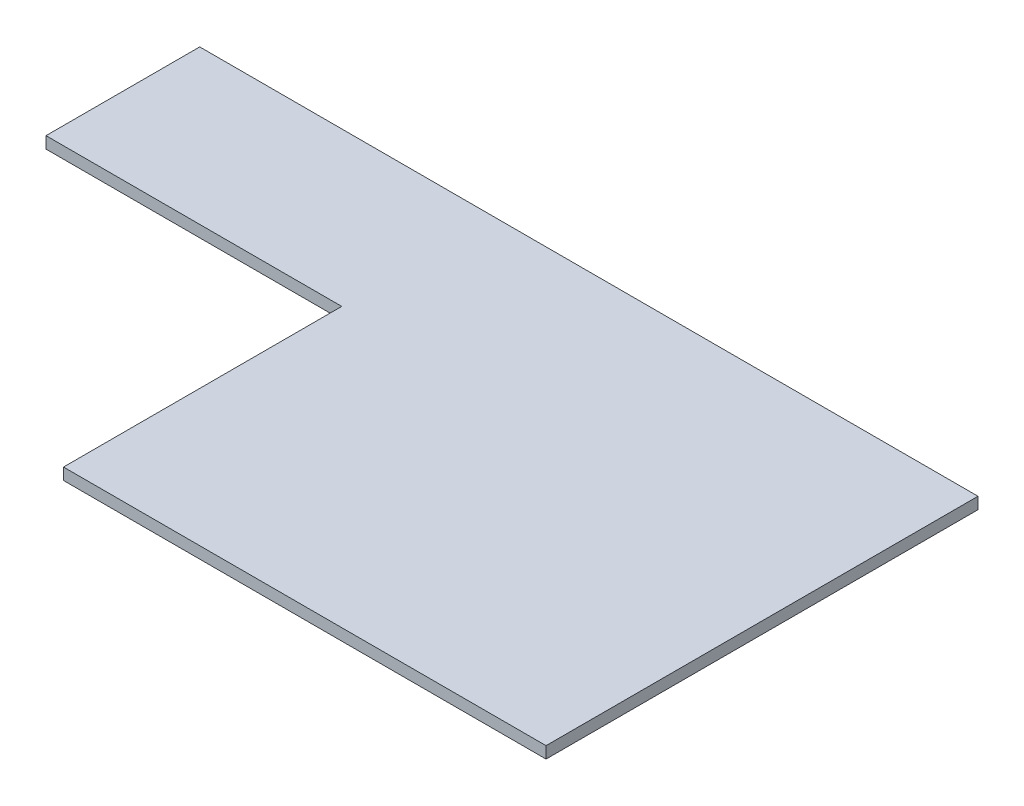
from build123d import *

# Parameters (mm, degrees)
BOSS_EXTRUDE1_DEPTH = 6


with BuildPart() as part:
    # Sketch1 → Boss-Extrude1 (new body)
    with BuildSketch(Plane(origin=(0, 0, 0), x_dir=(1, 0, 0), z_dir=(0, 1, 0))):
        Polygon((0, 0), (-248, 0), (-248, 143), (-400, 143), (-400, 222), (0, 222), align=None)
    extrude(amount=BOSS_EXTRUDE1_DEPTH)


solid = part.part
